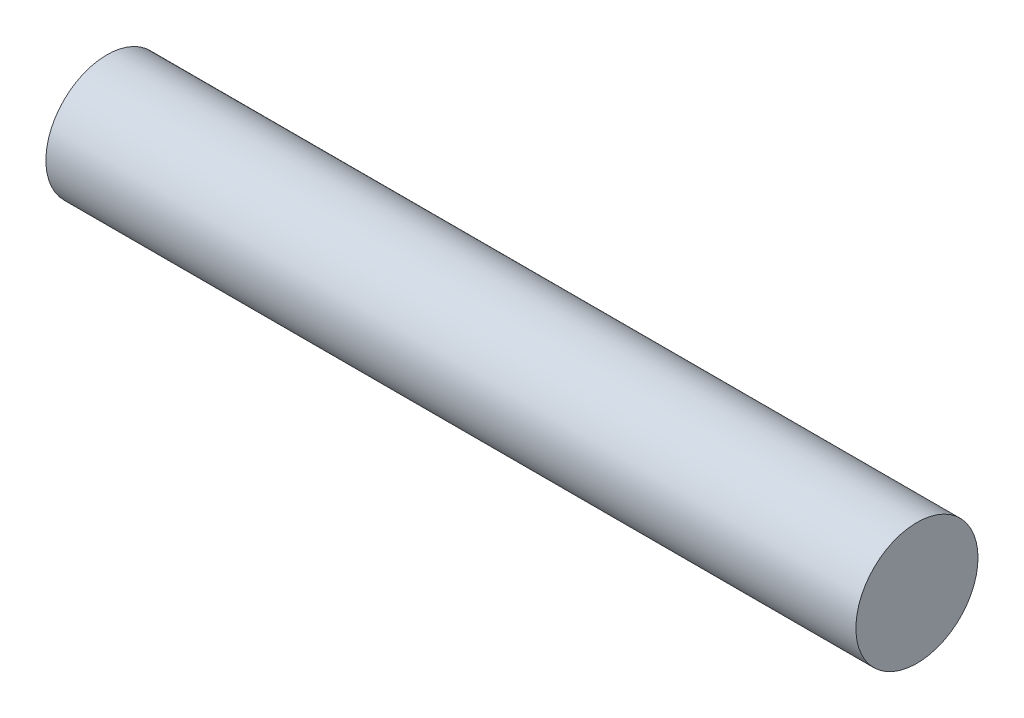
from build123d import *

# Parameters (mm, degrees)
CROQUIS1_W = 19.9
CROQUIS1_H = 1.5


with BuildPart() as part:
    # Croquis1 → Revolución1 (revolve)
    with BuildSketch(Plane.XY, mode=Mode.PRIVATE) as revoluci_n1_sk:
        with Locations((0, 0.75)):
            Rectangle(CROQUIS1_W, CROQUIS1_H)
    revolve(revoluci_n1_sk.sketch.rotate(Axis((9.95, 0, 0), (-1, 0, 0)), 90), axis=Axis((9.95, 0, 0), (-1, 0, 0)))


solid = part.part
